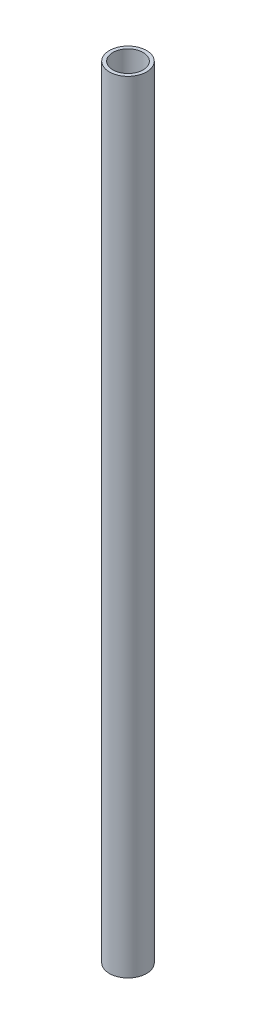
from build123d import *

# Parameters (mm, degrees)
SKETCH1_R           = 4.7625
SKETCH1_R_2         = 3.8735
BOSS_EXTRUDE1_DEPTH = 200.000108


with BuildPart() as part:
    # Sketch1 → Boss-Extrude1 (new body)
    with BuildSketch(Plane(origin=(0, 0, 0), x_dir=(1, 0, 0), z_dir=(0, 1, 0))):
        with Locations(Location((0, 0, 0), (0, 0, 270))):
            Circle(SKETCH1_R)
        with Locations(Location((0, 0, 0), (0, 0, 270))):
            Circle(SKETCH1_R_2, mode=Mode.SUBTRACT)
    extrude(amount=BOSS_EXTRUDE1_DEPTH)


solid = part.part
